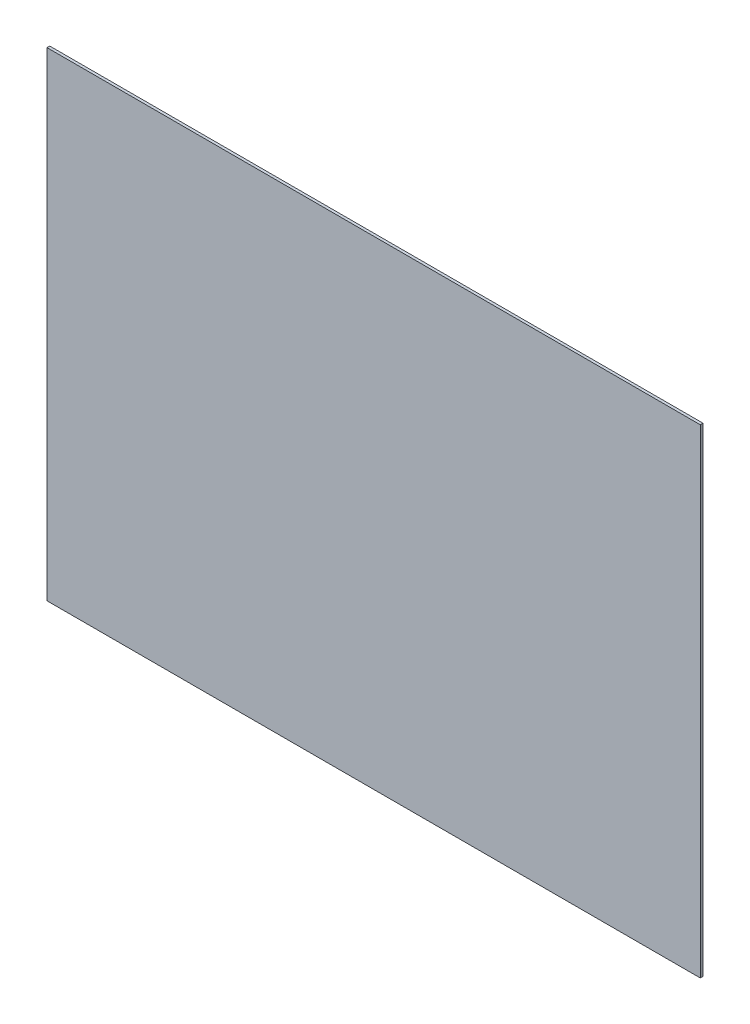
from build123d import *

# Parameters (mm, degrees)
SKETCH1_W           = 381
SKETCH1_H           = 279.4
BOSS_EXTRUDE1_DEPTH = 1.5875


with BuildPart() as part:
    # Sketch1 → Boss-Extrude1 (new body)
    with BuildSketch(Plane.XY):
        with Locations((190.5, 139.7)):
            Rectangle(SKETCH1_W, SKETCH1_H)
    extrude(amount=BOSS_EXTRUDE1_DEPTH)


solid = part.part
